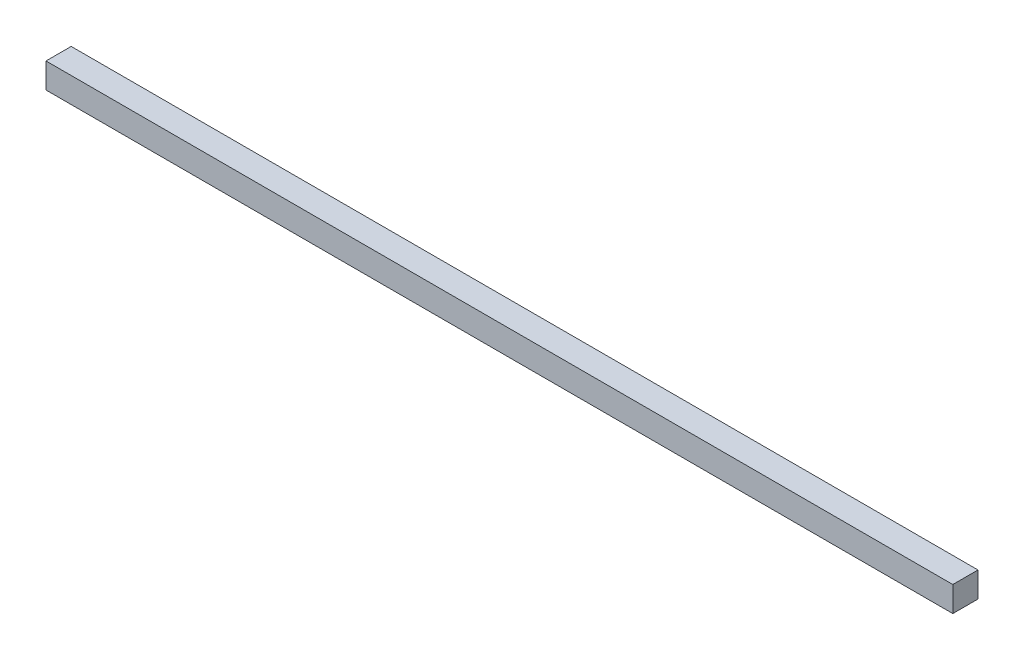
from build123d import *

# Parameters (mm, degrees)
SKETCH_1_W      = 180
SKETCH_1_H      = 5
EXTRUDE_1_DEPTH = 5


with BuildPart() as part:
    # ｽｹｯﾁ1 → ﾎﾞｽ - 押し出し1 (new body)
    with BuildSketch(Plane.XY):
        with Locations((7.848439705, 7.478571429)):
            Rectangle(SKETCH_1_W, SKETCH_1_H)
    extrude(amount=EXTRUDE_1_DEPTH)


solid = part.part
